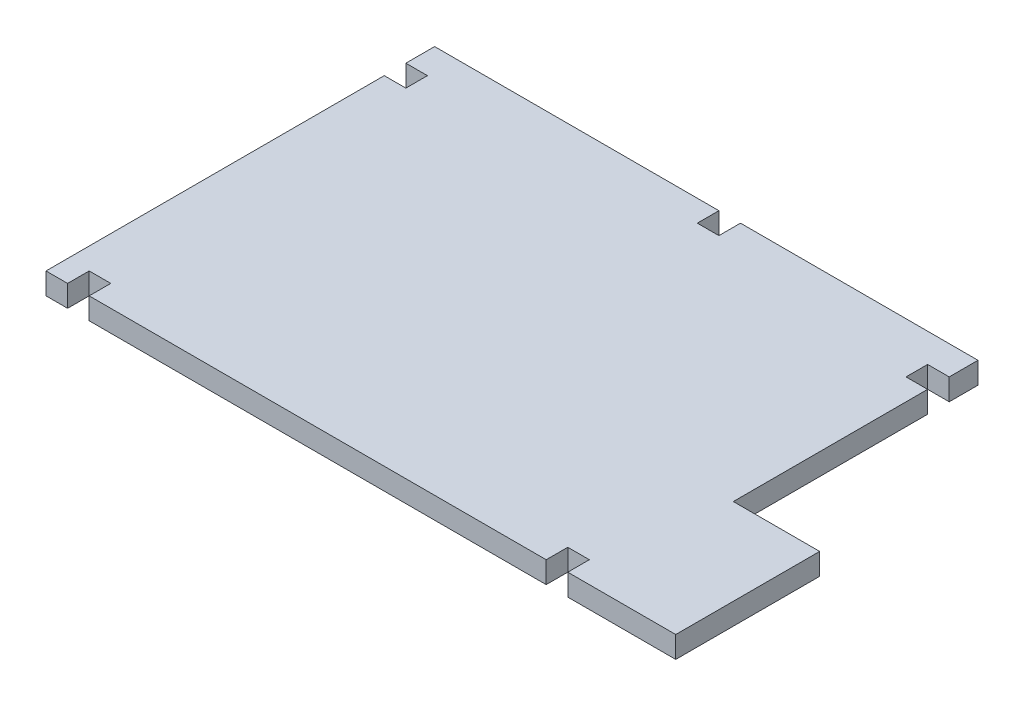
from build123d import *

# Parameters (mm, degrees)
EXTRUDE_1_DEPTH = 3


with BuildPart() as part:
    # 草图1 → 凸台-拉伸1 (new body)
    with BuildSketch(Plane(origin=(0, 0, 0), x_dir=(1, 0, 0), z_dir=(0, 1, 0))):
        Polygon((-67.312929012, 27.603789056), (-67.312929012, 23.603789056), (-64.312929012, 23.603789056), (-64.312929012, 20.603789056), (-67.312929012, 20.603789056), (-67.312929012, -26.396210944), (-64.312929012, -26.396210944), (-64.312929012, -23.396210944), (-61.312929012, -23.396210944), (-61.312929012, -26.396210944), (2.187070988, -26.396210944), (2.187070988, -23.396210944), (5.187070988, -23.396210944), (5.187070988, -26.396210944), (20.187070988, -26.396210944), (20.187070988, -6.396210944), (8.187070988, -6.396210944), (8.187070988, 20.603789056), (5.187070988, 20.603789056), (5.187070988, 23.603789056), (8.187070988, 23.603789056), (8.187070988, 27.603789056), (-24.812929012, 27.603789056), (-24.812929012, 24.603789056), (-27.812929012, 24.603789056), (-27.812929012, 27.603789056), align=None)
    extrude(amount=EXTRUDE_1_DEPTH)


solid = part.part
